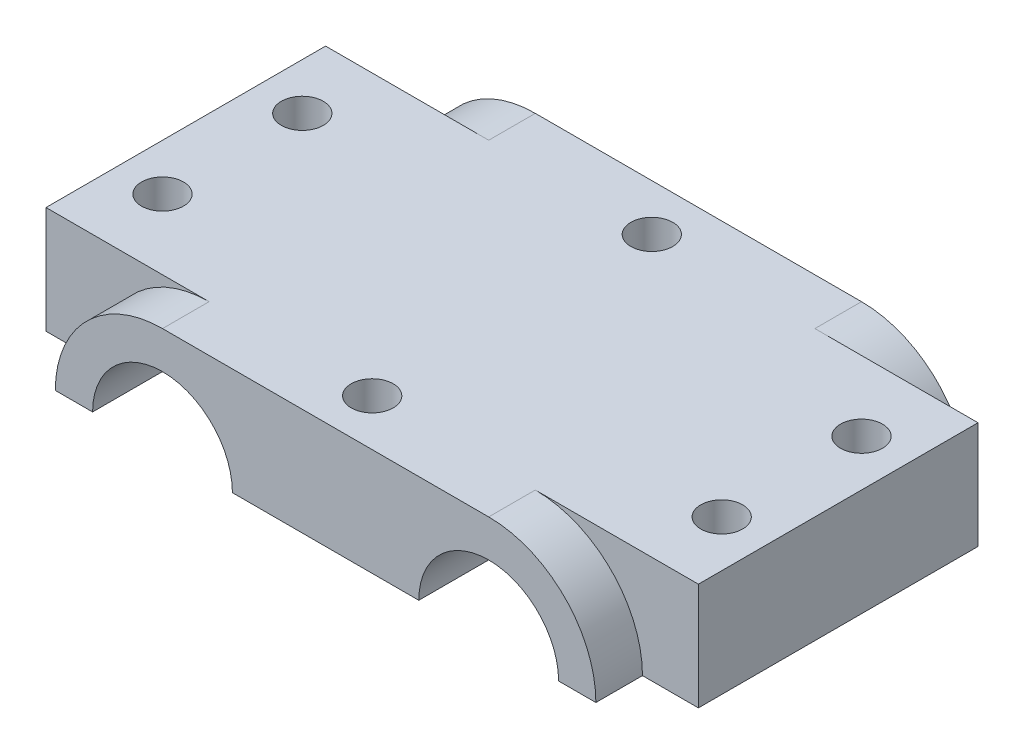
from build123d import *

# Parameters (mm, degrees)
SKETCH2_W             = 70
SKETCH2_H             = 11.5
BOSS_EXTRUDE1_DEPTH   = 20
CUT_EXTRUDE1_DEPTH    = 40
CUT_EXTRUDE2_DEPTH    = 5
F_1_0MM_DOWEL_HOLE1_D = 4.5
LPATTERN1_COUNT       = 2
LPATTERN1_PITCH       = 60
LPATTERN1_COUNT_DIR2  = 2
LPATTERN1_PITCH_DIR2  = 15
F_1_0MM_DOWEL_HOLE2_D = 4.5


with BuildPart() as part:
    # Sketch2 → Boss-Extrude1 (new, symmetric)
    with BuildSketch(Plane.XY):
        Rectangle(SKETCH2_W, SKETCH2_H)
    extrude(amount=BOSS_EXTRUDE1_DEPTH, both=True)

    # Sketch3 → Cut-Extrude1 (cut)
    with BuildSketch(Plane.XY.offset(20)):
        with BuildLine():
            Line((-25, -5.75), (-10, -5.75))
            ThreePointArc((-10, -5.75), (-17.5, 1.75), (-25, -5.75))
        make_face()
        with BuildLine():
            Line((10, -5.75), (25, -5.75))
            ThreePointArc((25, -5.75), (17.5, 1.75), (10, -5.75))
        make_face()
    extrude(amount=-CUT_EXTRUDE1_DEPTH, mode=Mode.SUBTRACT)

    # Sketch4 → Cut-Extrude2 (cut)
    with BuildSketch(Plane.XY.offset(20)):
        with BuildLine():
            Line((-35, -5.75), (-29, -5.75))
            ThreePointArc((-29, -5.75), (-25.631727984, 2.381727984), (-17.5, 5.75))
            Line((-17.5, 5.75), (-35, 5.75))
            Line((-35, 5.75), (-35, -5.75))
        make_face()
        with BuildLine():
            Line((35, 5.75), (17.5, 5.75))
            ThreePointArc((17.5, 5.75), (25.631727984, 2.381727984), (29, -5.75))
            Line((29, -5.75), (35, -5.75))
            Line((35, -5.75), (35, 5.75))
        make_face()
    cut_extrude2 = extrude(amount=-CUT_EXTRUDE2_DEPTH, mode=Mode.SUBTRACT)

    # Mirror1: Cut-Extrude2 across plane
    add(cut_extrude2.mirror(Plane.XY), mode=Mode.SUBTRACT)

    # Ø1.0mm Dowel Hole1 (through all)
    with Locations(Plane(origin=(0, 5.75, 0), x_dir=(1, 0, 0), z_dir=(0, 1, 0))):
        with Locations((30, -7.5)):
            f_1_0mm_dowel_hole1 = Hole(F_1_0MM_DOWEL_HOLE1_D / 2)

    # LPattern1: 1.0mm Dowel Hole1 2 × 2
    with Locations(*[(-i * LPATTERN1_PITCH, 0, -j * LPATTERN1_PITCH_DIR2) for i in range(LPATTERN1_COUNT) for j in range(LPATTERN1_COUNT_DIR2) if (i, j) != (0, 0)]):
        add(f_1_0mm_dowel_hole1, mode=Mode.SUBTRACT)

    # Ø1.0mm Dowel Hole2 (through all)
    with Locations(Plane(origin=(0, 5.75, 0), x_dir=(1, 0, 0), z_dir=(0, 1, 0))):
        with Locations((0, -15)):
            f_1_0mm_dowel_hole2 = Hole(F_1_0MM_DOWEL_HOLE2_D / 2)

    # Mirror2: Ø1.0mm Dowel Hole2 across plane
    add(f_1_0mm_dowel_hole2.mirror(Plane.XY), mode=Mode.SUBTRACT)


solid = part.part
